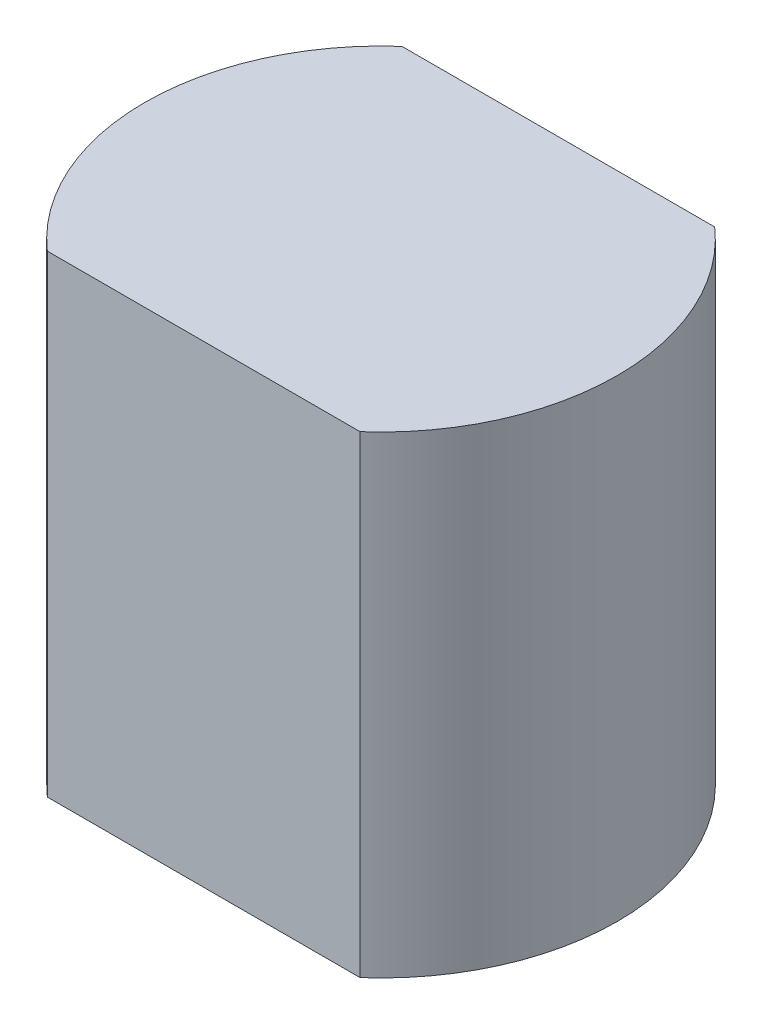
from build123d import *

# Parameters (mm, degrees)
BOSS_EXTRUDE1_DEPTH = 25.4
CUT_EXTRUDE1_DEPTH  = 0.79375


with BuildPart() as part:
    # Sketch1 → Boss-Extrude1 (new body)
    with BuildSketch(Plane(origin=(0, 0, 0), x_dir=(1, 0, 0), z_dir=(0, 1, 0))):
        with BuildLine():
            Line((8.400260413, 9.525), (-8.400260413, 9.525))
            ThreePointArc((-8.400260413, 9.525), (-12.7, 0), (-8.400260413, -9.525))
            Line((-8.400260413, -9.525), (8.400260413, -9.525))
            ThreePointArc((8.400260413, -9.525), (12.7, 0), (8.400260413, 9.525))
        make_face()
    extrude(amount=BOSS_EXTRUDE1_DEPTH)

    # Sketch2 → Cut-Extrude1 (cut)
    # profile 1 of 5: a face of its own
    with BuildSketch(Plane(origin=(0, 0, -9.525), x_dir=(-1, 0, 0), z_dir=(0, 0, -1))):
        Polygon((-7.286870366, 7.951394566), (-6.824831103, 11.451394566), (-6.779959308, 11.451394566), (-5.334947289, 8.579599694), (-3.893440878, 11.451394566), (-3.847867962, 11.451394566), (-3.383024212, 7.951394566), (-3.698529019, 7.951394566), (-4.033665237, 10.469824053), (-5.297086712, 7.951394566), (-5.367900013, 7.951394566), (-6.63622934, 10.475433027), (-6.970664436, 7.951394566), align=None)
    # profile 2 of 5: a face of its own
    with BuildSketch(Plane(origin=(0, 0, -9.525), x_dir=(-1, 0, 0), z_dir=(0, 0, -1))):
        with BuildLine():
            add(Edge.make_bspline(
                [(-1.519442481, 10.553958668), (-1.471451208, 10.552936777), (-1.37735205, 10.550933098), (-1.239544165, 10.529518133), (-1.107999029, 10.496770768), (-0.982212837, 10.451499206), (-0.863796541, 10.390817256), (-0.751025297, 10.318407965), (-0.644208288, 10.232625371), (-0.580185259, 10.166267303), (-0.547687673, 10.13258447)],
                knots=[0, 0, 0, 0, 1.054011418, 2.066658804, 3.057071809, 4.030435133, 4.997543892, 5.974964718, 6.972108034, 8, 8, 8, 8], degree=3))
            add(Edge.make_bspline(
                [(-0.547687673, 10.13258447), (-0.519705719, 10.100370484), (-0.464283339, 10.036565942), (-0.39321762, 9.933110329), (-0.33199606, 9.825970228), (-0.282933099, 9.713722901), (-0.244248075, 9.59734823), (-0.216782379, 9.476446219), (-0.200445444, 9.351283872), (-0.198242477, 9.266280034), (-0.197126776, 9.223229502)],
                knots=[0, 0, 0, 0, 1.025258237, 2.030674902, 3.01204498, 3.988269485, 4.97094183, 5.956517959, 6.965070386, 8, 8, 8, 8], degree=3))
            add(Edge.make_bspline(
                [(-0.197126776, 9.223229502), (-0.198108113, 9.179929444), (-0.200047281, 9.094366511), (-0.218390898, 8.968347145), (-0.246921984, 8.846152322), (-0.287753822, 8.728293628), (-0.340111931, 8.614410801), (-0.404002619, 8.505001252), (-0.479874236, 8.399849119), (-0.565878233, 8.29984728), (-0.660930109, 8.207681065), (-0.764046257, 8.127352796), (-0.873200291, 8.058531272), (-0.989843644, 8.003094856), (-1.112911131, 7.959385156), (-1.242668199, 7.928685139), (-1.378913269, 7.910123455), (-1.471940491, 7.907739882), (-1.519442481, 7.906522771)],
                knots=[0, 0, 0, 0, 0.998656419, 1.973391657, 2.932242238, 3.890759089, 4.846373663, 5.82037756, 6.809684879, 7.83454468, 8.860553229, 9.859544525, 10.845671541, 11.83227036, 12.833544569, 13.85385346, 14.904124723, 16, 16, 16, 16], degree=3))
            add(Edge.make_bspline(
                [(-1.519442481, 7.906522771), (-1.5671772, 7.907743967), (-1.66066806, 7.910135742), (-1.797394042, 7.928613024), (-1.927383661, 7.959371007), (-2.05061226, 8.0032385), (-2.167757106, 8.058533043), (-2.277543603, 8.127144733), (-2.380743519, 8.207704888), (-2.475815503, 8.299840825), (-2.561814109, 8.399850782), (-2.637687117, 8.50500082), (-2.701577443, 8.614410914), (-2.753935647, 8.728293598), (-2.79476746, 8.84615233), (-2.823298553, 8.968347143), (-2.841642167, 9.094366511), (-2.843581336, 9.179929444), (-2.844562673, 9.223229502)],
                knots=[0, 0, 0, 0, 1.099876186, 2.154163076, 3.173186993, 4.173200201, 5.163417411, 6.152872554, 7.150605724, 8.17532212, 9.198891216, 10.186952605, 11.159729845, 12.11414092, 13.071450619, 14.029093627, 15.002601286, 16, 16, 16, 16], degree=3))
            add(Edge.make_bspline(
                [(-2.844562673, 9.223229502), (-2.843439363, 9.266046048), (-2.841215401, 9.35081545), (-2.824894892, 9.475742511), (-2.797536336, 9.5964399), (-2.758804939, 9.712365376), (-2.709289749, 9.824120812), (-2.648928461, 9.931525643), (-2.577137828, 10.034513443), (-2.521935876, 10.098235523), (-2.494001776, 10.130481104)],
                knots=[0, 0, 0, 0, 1.031353054, 2.041901799, 3.029428768, 4.008703097, 4.981709435, 5.96992636, 6.972712378, 8, 8, 8, 8], degree=3))
            add(Edge.make_bspline(
                [(-2.494001776, 10.130481104), (-2.461553185, 10.164456044), (-2.397737321, 10.23127374), (-2.290388593, 10.316806264), (-2.177894772, 10.390722338), (-2.058169846, 10.450198553), (-1.932486988, 10.497037071), (-1.800267745, 10.529602586), (-1.66199223, 10.550855941), (-1.567432609, 10.552914119), (-1.519442481, 10.553958668)],
                knots=[0, 0, 0, 0, 1.027980169, 2.021703884, 2.998553061, 3.971491411, 4.943284454, 5.930300938, 6.949603206, 8, 8, 8, 8], degree=3))
        make_face()
        with BuildLine():
            add(Edge.make_bspline(
                [(-1.520844724, 10.239856104), (-1.554782336, 10.238891513), (-1.621781464, 10.23698723), (-1.720401049, 10.222503325), (-1.815341203, 10.199555821), (-1.906782047, 10.166951765), (-1.99441522, 10.124852866), (-2.078324622, 10.073144506), (-2.158757062, 10.012511549), (-2.234139125, 9.943048878), (-2.303321438, 9.867169883), (-2.363799414, 9.786321524), (-2.41522452, 9.701815178), (-2.458064679, 9.613562967), (-2.489971868, 9.520670553), (-2.51314489, 9.424189922), (-2.52761513, 9.323924505), (-2.529501509, 9.255763487), (-2.530460109, 9.221126136)],
                knots=[0, 0, 0, 0, 1.021534396, 2.016698045, 2.994645724, 3.958388632, 4.93408049, 5.916473867, 6.921342795, 7.962252576, 8.998418191, 10.008913653, 10.997312074, 11.973003931, 12.956656626, 13.948281152, 14.957379055, 16, 16, 16, 16], degree=3))
            add(Edge.make_bspline(
                [(-2.530460109, 9.221126136), (-2.528853285, 9.176374109), (-2.525664041, 9.087549704), (-2.499728805, 8.956738581), (-2.456342525, 8.831156729), (-2.397755245, 8.711540343), (-2.324349026, 8.600868065), (-2.23786196, 8.50219658), (-2.139222259, 8.417010769), (-2.029605759, 8.346329923), (-1.911251441, 8.290170168), (-1.78599512, 8.250371192), (-1.655354426, 8.2244995), (-1.566073695, 8.221928025), (-1.520844724, 8.220625335)],
                knots=[0, 0, 0, 0, 1.016792936, 2.018143844, 3.017858371, 4.030088057, 5.03801393, 6.028138512, 7.003788237, 7.991172063, 8.984598303, 9.972568034, 10.972917682, 12, 12, 12, 12], degree=3))
            add(Edge.make_bspline(
                [(-1.520844724, 8.220625335), (-1.475618356, 8.221935615), (-1.38634276, 8.224522072), (-1.255883583, 8.250240892), (-1.130969611, 8.290344553), (-1.012738223, 8.346266762), (-0.90317162, 8.417279177), (-0.803822499, 8.501715554), (-0.718073887, 8.601129406), (-0.644740283, 8.711686934), (-0.58519354, 8.830971287), (-0.542010338, 8.956761759), (-0.516012752, 9.087543801), (-0.512831923, 9.176372132), (-0.51122934, 9.221126136)],
                knots=[0, 0, 0, 0, 1.02726834, 2.027799167, 3.010890988, 4.004497153, 4.992059811, 5.971914811, 6.958719428, 7.966827853, 8.981595046, 9.981490638, 10.983022906, 12, 12, 12, 12], degree=3))
            add(Edge.make_bspline(
                [(-0.51122934, 9.221126136), (-0.51218761, 9.255763694), (-0.514073339, 9.32392512), (-0.528548303, 9.424187573), (-0.551703843, 9.52067917), (-0.58367546, 9.613531173), (-0.626329474, 9.702043678), (-0.678746267, 9.786073405), (-0.738977293, 9.867449951), (-0.808994414, 9.942803591), (-0.884297791, 10.012538628), (-0.96476283, 10.073168017), (-1.048547808, 10.124625613), (-1.135926391, 10.167311853), (-1.227378959, 10.199259194), (-1.322186088, 10.222635825), (-1.420384898, 10.236926022), (-1.487143941, 10.238873163), (-1.520844724, 10.239856104)],
                knots=[0, 0, 0, 0, 1.042956736, 2.052379634, 3.044323526, 4.02829302, 5.004299113, 5.996692471, 7.007513377, 8.048758398, 9.090003419, 10.095195979, 11.07790575, 12.047570684, 13.018257071, 13.989683339, 14.985167495, 16, 16, 16, 16], degree=3))
        make_face(mode=Mode.SUBTRACT)
    # profile 3 of 5: a face of its own
    with BuildSketch(Plane(origin=(0, 0, -9.525), x_dir=(-1, 0, 0), z_dir=(0, 0, -1))):
        Polygon((0.745180917, 11.541138156), (1.059283481, 11.541138156), (1.059283481, 10.509086874), (1.508001429, 10.509086874), (1.508001429, 10.194984309), (1.059283481, 10.194984309), (1.059283481, 7.951394566), (0.745180917, 7.951394566), (0.745180917, 10.194984309), (0.296462968, 10.194984309), (0.296462968, 10.509086874), (0.745180917, 10.509086874), align=None)
    # profile 4 of 5: a face of its own
    with BuildSketch(Plane(origin=(0, 0, -9.525), x_dir=(-1, 0, 0), z_dir=(0, 0, -1))):
        with BuildLine():
            add(Edge.make_bspline(
                [(3.28183957, 10.553958668), (3.329830843, 10.552936777), (3.423930001, 10.550933098), (3.561737887, 10.529518133), (3.693283023, 10.496770768), (3.819069215, 10.451499206), (3.93748551, 10.390817256), (4.050256754, 10.318407965), (4.157073763, 10.232625371), (4.221096792, 10.166267303), (4.253594378, 10.13258447)],
                knots=[0, 0, 0, 0, 1.054011418, 2.066658804, 3.057071809, 4.030435133, 4.997543892, 5.974964718, 6.972108034, 8, 8, 8, 8], degree=3))
            add(Edge.make_bspline(
                [(4.253594378, 10.13258447), (4.281576332, 10.100370484), (4.336998712, 10.036565942), (4.408064431, 9.933110329), (4.469285991, 9.825970228), (4.518348952, 9.713722901), (4.557033976, 9.59734823), (4.584499672, 9.476446219), (4.600836607, 9.351283872), (4.603039574, 9.266280034), (4.604155276, 9.223229502)],
                knots=[0, 0, 0, 0, 1.025258237, 2.030674902, 3.01204498, 3.988269485, 4.97094183, 5.956517959, 6.965070386, 8, 8, 8, 8], degree=3))
            add(Edge.make_bspline(
                [(4.604155276, 9.223229502), (4.603173938, 9.179929444), (4.60123477, 9.094366511), (4.582891153, 8.968347145), (4.554360068, 8.846152322), (4.513528229, 8.728293628), (4.46117012, 8.614410801), (4.397279433, 8.505001252), (4.321407815, 8.399849119), (4.235403819, 8.29984728), (4.140351943, 8.207681065), (4.037235794, 8.127352796), (3.928081761, 8.058531272), (3.811438407, 8.003094856), (3.68837092, 7.959385156), (3.558613852, 7.928685139), (3.422368782, 7.910123455), (3.329341561, 7.907739882), (3.28183957, 7.906522771)],
                knots=[0, 0, 0, 0, 0.998656419, 1.973391657, 2.932242238, 3.890759089, 4.846373663, 5.82037756, 6.809684879, 7.83454468, 8.860553229, 9.859544525, 10.845671541, 11.83227036, 12.833544569, 13.85385346, 14.904124723, 16, 16, 16, 16], degree=3))
            add(Edge.make_bspline(
                [(3.28183957, 7.906522771), (3.234104851, 7.907743967), (3.140613991, 7.910135742), (3.003888009, 7.928613024), (2.87389839, 7.959371007), (2.750669792, 8.0032385), (2.633524945, 8.058533043), (2.523738448, 8.127144733), (2.420538532, 8.207704888), (2.325466548, 8.299840825), (2.239467943, 8.399850782), (2.163594934, 8.50500082), (2.099704608, 8.614410914), (2.047346404, 8.728293598), (2.006514591, 8.84615233), (1.977983499, 8.968347143), (1.959639884, 9.094366511), (1.957700716, 9.179929444), (1.956719378, 9.223229502)],
                knots=[0, 0, 0, 0, 1.099876186, 2.154163076, 3.173186993, 4.173200201, 5.163417411, 6.152872554, 7.150605724, 8.17532212, 9.198891216, 10.186952605, 11.159729845, 12.11414092, 13.071450619, 14.029093627, 15.002601286, 16, 16, 16, 16], degree=3))
            add(Edge.make_bspline(
                [(1.956719378, 9.223229502), (1.957842688, 9.266046048), (1.96006665, 9.35081545), (1.976387159, 9.475742511), (2.003745715, 9.5964399), (2.042477112, 9.712365376), (2.091992303, 9.824120812), (2.152353591, 9.931525643), (2.224144223, 10.034513443), (2.279346175, 10.098235523), (2.307280276, 10.130481104)],
                knots=[0, 0, 0, 0, 1.031353054, 2.041901799, 3.029428768, 4.008703097, 4.981709435, 5.96992636, 6.972712378, 8, 8, 8, 8], degree=3))
            add(Edge.make_bspline(
                [(2.307280276, 10.130481104), (2.339728867, 10.164456044), (2.40354473, 10.23127374), (2.510893458, 10.316806264), (2.623387279, 10.390722338), (2.743112205, 10.450198553), (2.868795063, 10.497037071), (3.001014306, 10.529602586), (3.139289821, 10.550855941), (3.233849442, 10.552914119), (3.28183957, 10.553958668)],
                knots=[0, 0, 0, 0, 1.027980169, 2.021703884, 2.998553061, 3.971491411, 4.943284454, 5.930300938, 6.949603206, 8, 8, 8, 8], degree=3))
        make_face()
        with BuildLine():
            add(Edge.make_bspline(
                [(3.280437327, 10.239856104), (3.246499715, 10.238891513), (3.179500587, 10.23698723), (3.080881002, 10.222503325), (2.985940848, 10.199555821), (2.894500004, 10.166951765), (2.806866832, 10.124852866), (2.722957429, 10.073144506), (2.642524989, 10.012511549), (2.567142926, 9.943048878), (2.497960614, 9.867169883), (2.437482637, 9.786321524), (2.386057531, 9.701815178), (2.343217372, 9.613562967), (2.311310184, 9.520670553), (2.288137161, 9.424189922), (2.273666921, 9.323924505), (2.271780542, 9.255763487), (2.270821942, 9.221126136)],
                knots=[0, 0, 0, 0, 1.021534396, 2.016698045, 2.994645724, 3.958388632, 4.93408049, 5.916473867, 6.921342795, 7.962252576, 8.998418191, 10.008913653, 10.997312074, 11.973003931, 12.956656626, 13.948281152, 14.957379055, 16, 16, 16, 16], degree=3))
            add(Edge.make_bspline(
                [(2.270821942, 9.221126136), (2.272428766, 9.176374109), (2.27561801, 9.087549704), (2.301553247, 8.956738581), (2.344939527, 8.831156729), (2.403526806, 8.711540343), (2.476933025, 8.600868065), (2.563420092, 8.50219658), (2.662059792, 8.417010769), (2.771676292, 8.346329923), (2.89003061, 8.290170168), (3.015286931, 8.250371192), (3.145927625, 8.2244995), (3.235208356, 8.221928025), (3.280437327, 8.220625335)],
                knots=[0, 0, 0, 0, 1.016792936, 2.018143844, 3.017858371, 4.030088057, 5.03801393, 6.028138512, 7.003788237, 7.991172063, 8.984598303, 9.972568034, 10.972917682, 12, 12, 12, 12], degree=3))
            add(Edge.make_bspline(
                [(3.280437327, 8.220625335), (3.325663696, 8.221935615), (3.414939292, 8.224522072), (3.545398469, 8.250240892), (3.67031244, 8.290344553), (3.788543828, 8.346266762), (3.898110431, 8.417279177), (3.997459553, 8.501715554), (4.083208164, 8.601129406), (4.156541769, 8.711686934), (4.216088511, 8.830971287), (4.259271713, 8.956761759), (4.285269299, 9.087543801), (4.288450128, 9.176372132), (4.290052711, 9.221126136)],
                knots=[0, 0, 0, 0, 1.02726834, 2.027799167, 3.010890988, 4.004497153, 4.992059811, 5.971914811, 6.958719428, 7.966827853, 8.981595046, 9.981490638, 10.983022906, 12, 12, 12, 12], degree=3))
            add(Edge.make_bspline(
                [(4.290052711, 9.221126136), (4.289094441, 9.255763694), (4.287208712, 9.32392512), (4.272733748, 9.424187573), (4.249578208, 9.52067917), (4.217606591, 9.613531173), (4.174952577, 9.702043678), (4.122535784, 9.786073405), (4.062304759, 9.867449951), (3.992287638, 9.942803591), (3.91698426, 10.012538628), (3.836519222, 10.073168017), (3.752734243, 10.124625613), (3.66535566, 10.167311853), (3.573903093, 10.199259194), (3.479095964, 10.222635825), (3.380897154, 10.236926022), (3.31413811, 10.238873163), (3.280437327, 10.239856104)],
                knots=[0, 0, 0, 0, 1.042956736, 2.052379634, 3.044323526, 4.02829302, 5.004299113, 5.996692471, 7.007513377, 8.048758398, 9.090003419, 10.095195979, 11.07790575, 12.047570684, 13.018257071, 13.989683339, 14.985167495, 16, 16, 16, 16], degree=3))
        make_face(mode=Mode.SUBTRACT)
    # profile 5 of 5: a face of its own
    with BuildSketch(Plane(origin=(0, 0, -9.525), x_dir=(-1, 0, 0), z_dir=(0, 0, -1))):
        with BuildLine():
            Line((5.142616814, 10.509086874), (5.456719378, 10.509086874))
            Line((5.456719378, 10.509086874), (5.456719378, 10.13258447))
            add(Edge.make_bspline(
                [(5.456719378, 10.13258447), (5.479908137, 10.167640298), (5.524256458, 10.234684297), (5.597969387, 10.323353598), (5.673472718, 10.396768645), (5.751127906, 10.455272164), (5.831506006, 10.499085282), (5.912842957, 10.531178318), (5.996418427, 10.550155633), (6.052580351, 10.552689292), (6.080717776, 10.553958668)],
                knots=[0, 0, 0, 0, 1.2804753, 2.448899062, 3.506932113, 4.484331642, 5.4025378, 6.288909075, 7.142734305, 8, 8, 8, 8], degree=3))
            add(Edge.make_bspline(
                [(6.080717776, 10.553958668), (6.102544102, 10.552768142), (6.147453187, 10.550318556), (6.215435777, 10.533107731), (6.285479229, 10.505629709), (6.330621616, 10.479789486), (6.354155276, 10.466318444)],
                knots=[0, 0, 0, 0, 0.901110191, 1.854092781, 2.881294221, 4, 4, 4, 4], degree=3))
            Line((6.354155276, 10.466318444), (6.181679314, 10.194283188))
            add(Edge.make_bspline(
                [(6.181679314, 10.194283188), (6.166570293, 10.201023454), (6.137890478, 10.213817769), (6.095935912, 10.228959779), (6.057254575, 10.237875695), (6.032611017, 10.239226413), (6.021122423, 10.239856104)],
                knots=[0, 0, 0, 0, 1.180555205, 2.24091978, 3.179933427, 4, 4, 4, 4], degree=3))
            add(Edge.make_bspline(
                [(6.021122423, 10.239856104), (5.995916689, 10.238176067), (5.944504299, 10.234749278), (5.8690198, 10.20781047), (5.795772595, 10.16428523), (5.737600932, 10.116014118), (5.692558679, 10.06946632), (5.660418454, 10.028817918), (5.630935707, 9.983239286), (5.602765486, 9.933509603), (5.577099192, 9.878779757), (5.553144523, 9.819596543), (5.53148566, 9.755891414), (5.519135416, 9.711508894), (5.512809122, 9.688774374)],
                knots=[0, 0, 0, 0, 1.125678352, 2.296057538, 3.5422874, 4.923748041, 5.663163013, 6.437101912, 7.23742474, 8.08941207, 8.991984279, 9.93940061, 10.944477711, 12, 12, 12, 12], degree=3))
            add(Edge.make_bspline(
                [(5.512809122, 9.688774374), (5.508076728, 9.6684972), (5.497594837, 9.623584801), (5.487403299, 9.548236277), (5.477333781, 9.459212618), (5.470237162, 9.356266025), (5.46365912, 9.239653581), (5.459949038, 9.109197635), (5.456845898, 8.964764284), (5.456762831, 8.863789931), (5.456719378, 8.810969886)],
                knots=[0, 0, 0, 0, 0.566838948, 1.255505196, 2.06880316, 3.007127437, 4.065329342, 5.249902469, 6.561414163, 8, 8, 8, 8], degree=3))
            Line((5.456719378, 8.810969886), (5.456719378, 7.951394566))
            Line((5.456719378, 7.951394566), (5.142616814, 7.951394566))
            Line((5.142616814, 7.951394566), (5.142616814, 10.509086874))
        make_face()
    extrude(amount=-CUT_EXTRUDE1_DEPTH, mode=Mode.SUBTRACT)


solid = part.part
